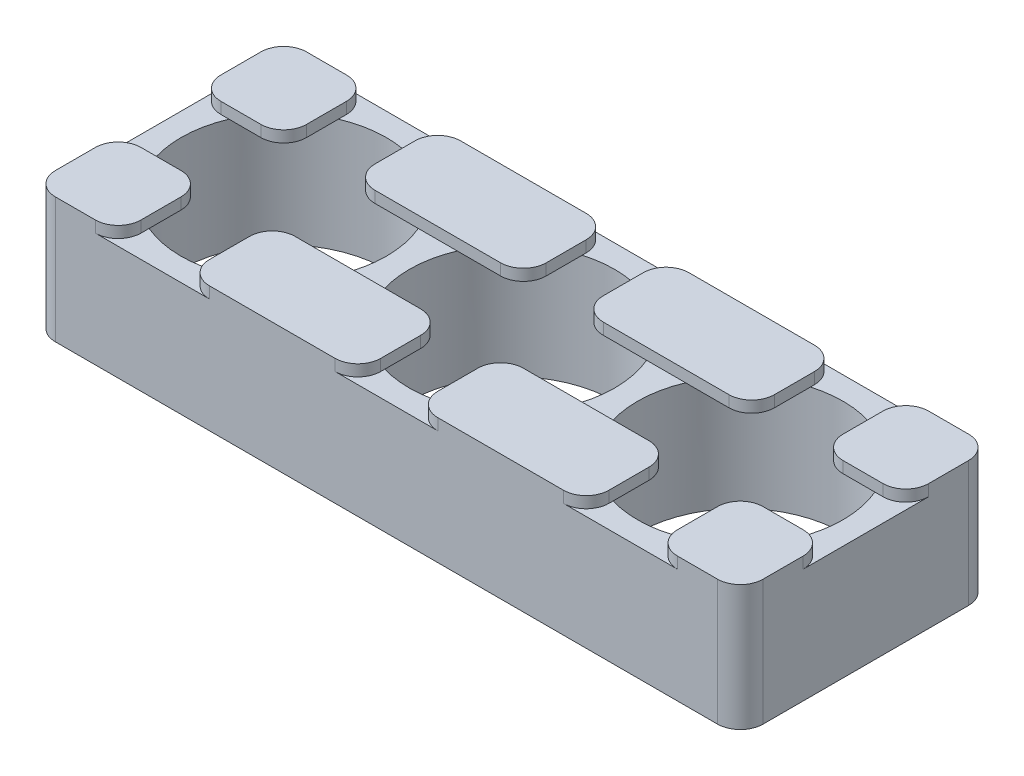
from build123d import *

# Parameters (mm, degrees)
SKETCH1_W           = 62
SKETCH1_H           = 22
SKETCH1_R           = 9
BOSS_EXTRUDE3_DEPTH = 10
BOSS_EXTRUDE4_START = 10
SKETCH3_W           = 7.5
SKETCH3_H           = 7.5
SKETCH3_W_2         = 15
BOSS_EXTRUDE4_DEPTH = 1
FILLET3_R           = 2


with BuildPart() as part:
    # Sketch1 → Boss-Extrude3 (new body)
    with BuildSketch(Plane(origin=(0, 0, 0), x_dir=(1, 0, 0), z_dir=(0, 1, 0))):
        with Locations((20, 0)):
            Rectangle(SKETCH1_W, SKETCH1_H)
        with Locations(Location((0, 0, 0), (0, 0, 270))):
            Circle(SKETCH1_R, mode=Mode.SUBTRACT)
        with Locations(Location((20, 0, 0), (0, 0, 270))):
            Circle(SKETCH1_R, mode=Mode.SUBTRACT)
        with Locations(Location((40, 0, 0), (0, 0, 270))):
            Circle(SKETCH1_R, mode=Mode.SUBTRACT)
    extrude(amount=BOSS_EXTRUDE3_DEPTH)

    # Sketch3 → Boss-Extrude4 (add)
    with BuildSketch(Plane(origin=(0, 0, 0), x_dir=(-1, 0, 0), z_dir=(0, 1, 0)).offset(BOSS_EXTRUDE4_START)):
        with Locations((7.25, 7.25)):
            Rectangle(SKETCH3_W, SKETCH3_H)
        with Locations((-10, 7.25)):
            Rectangle(SKETCH3_W_2, SKETCH3_H)
        with Locations((-30, 7.25)):
            Rectangle(SKETCH3_W_2, SKETCH3_H)
        with Locations((-47.25, -7.25)):
            Rectangle(SKETCH3_W, SKETCH3_H)
        with Locations((-47.25, 7.25)):
            Rectangle(SKETCH3_W, SKETCH3_H)
        with Locations((-30, -7.25)):
            Rectangle(SKETCH3_W_2, SKETCH3_H)
        with Locations((-10, -7.25)):
            Rectangle(SKETCH3_W_2, SKETCH3_H)
        with Locations((7.25, -7.25)):
            Rectangle(SKETCH3_W, SKETCH3_H)
    extrude(amount=BOSS_EXTRUDE4_DEPTH)

    # Fillet3
    fillet3_edges = [part.edges().sort_by_distance(p)[0] for p in [
        (37.5, 10.5, -11),
        (22.5, 10.5, -11),
        (22.5, 10.5, -3.5),
        (37.5, 10.5, -3.5),
        (2.5, 10.5, -3.5),
        (17.5, 10.5, -3.5),
        (17.5, 10.5, -11),
        (2.5, 10.5, -11),
        (-11, 10.5, -3.5),
        (-3.5, 10.5, -3.5),
        (-3.5, 10.5, -11),
        (-3.5, 10.5, 11),
        (-3.5, 10.5, 3.5),
        (-11, 10.5, 3.5),
        (17.5, 10.5, 3.5),
        (2.5, 10.5, 3.5),
        (2.5, 10.5, 11),
        (17.5, 10.5, 11),
        (43.5, 10.5, 3.5),
        (43.5, 10.5, 11),
        (51, 10.5, 3.5),
        (37.5, 10.5, 3.5),
        (22.5, 10.5, 3.5),
        (22.5, 10.5, 11),
        (37.5, 10.5, 11),
        (-11, 5.5, -11),
        (51, 5.5, -11),
        (51, 5.5, 11),
        (-11, 5.5, 11),
        (43.5, 10.5, -3.5),
        (51, 10.5, -3.5),
        (43.5, 10.5, -11),
    ]]
    fillet(fillet3_edges, radius=FILLET3_R)


solid = part.part
